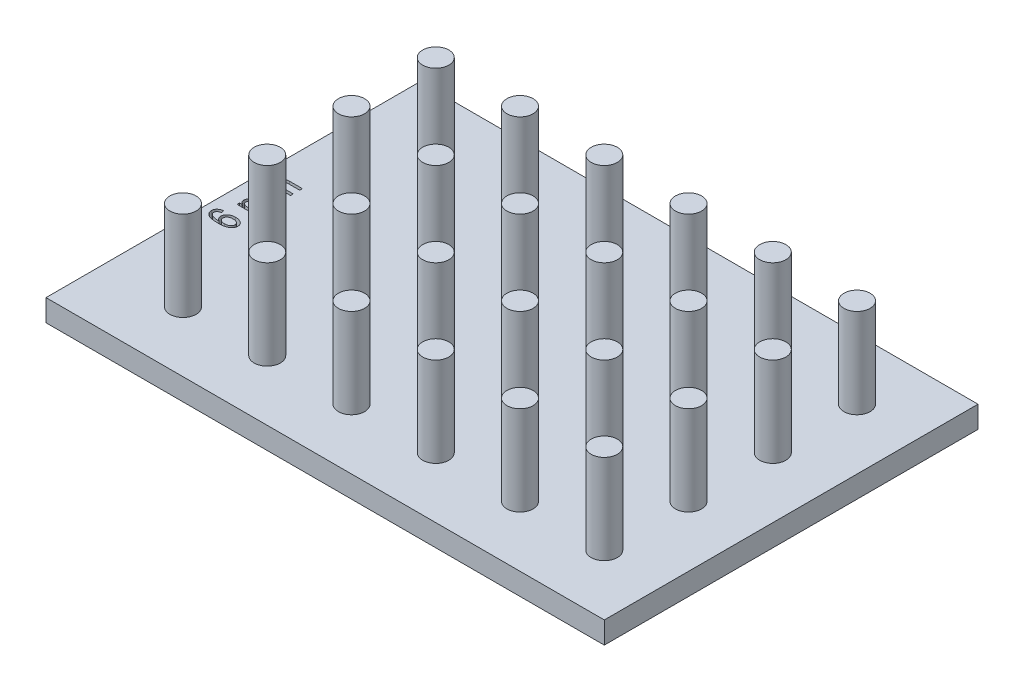
from build123d import *

# Parameters (mm, degrees)
SKETCH2_W            = 3
SKETCH2_H            = 20.5
SKETCH1_W            = 127.89
SKETCH1_H            = 85.6
BOSS_EXTRUDE2_DEPTH  = 5
LPATTERN2_COUNT      = 4
LPATTERN2_PITCH      = 19.3
LPATTERN2_COUNT_DIR2 = 6
LPATTERN2_PITCH_DIR2 = 19.3
CUT_EXTRUDE1_DEPTH   = 2


with BuildPart() as part:
    # Sketch2 → Revolve1 (revolve)
    with BuildSketch(Plane.XY.offset(-28.96), mode=Mode.PRIVATE) as revolve1_sk:
        with Locations((51.575, 10.25)):
            Rectangle(SKETCH2_W, SKETCH2_H)
    revolve1 = revolve(revolve1_sk.sketch.rotate(Axis((50.075, 20.5, -28.96), (0, -1, 0)), 90), axis=Axis((50.075, 20.5, -28.96), (0, -1, 0)))

    # Sketch1 → Boss-Extrude2 (add)
    with BuildSketch(Plane(origin=(0, 0, 0), x_dir=(1, 0, 0), z_dir=(0, 1, 0))):
        Rectangle(SKETCH1_W, SKETCH1_H)
    extrude(amount=-BOSS_EXTRUDE2_DEPTH)

    # LPattern2: Revolve1 4 × 6
    with Locations(*[(-j * LPATTERN2_PITCH_DIR2, 0, i * LPATTERN2_PITCH) for i in range(LPATTERN2_COUNT) for j in range(LPATTERN2_COUNT_DIR2) if (i, j) != (0, 0)]):
        add(revolve1)

    # Sketch5 → Cut-Extrude1 (cut)
    # profile 1 of 3: a face of its own
    with BuildSketch(Plane(origin=(0, 0, 0), x_dir=(1, 0, 0), z_dir=(0, 1, 0))):
        with BuildLine():
            Line((-56.194773063, 3.350649351), (-60.558409427, 3.350649351))
            Line((-60.558409427, 3.350649351), (-60.558409427, 3.896103896))
            Line((-60.558409427, 3.896103896), (-59.943555531, 3.896103896))
            add(Edge.make_bspline(
                [(-59.943555531, 3.896103896), (-59.996794447, 3.926822249), (-60.100876583, 3.98687666), (-60.239062939, 4.097881311), (-60.358476936, 4.22059706), (-60.45906551, 4.354856807), (-60.53843865, 4.499547799), (-60.594562214, 4.652256173), (-60.630633743, 4.811226722), (-60.634416703, 4.91985422), (-60.636331505, 4.974837662)],
                knots=[0, 0, 0, 0, 1.09277774, 2.136381581, 3.142818198, 4.133971442, 5.113525656, 6.068968217, 7.022579197, 8, 8, 8, 8], degree=3))
            add(Edge.make_bspline(
                [(-60.636331505, 4.974837662), (-60.634088382, 5.035494154), (-60.629756514, 5.152632593), (-60.593642069, 5.321259578), (-60.534033829, 5.474930057), (-60.449967949, 5.61337419), (-60.342936808, 5.735607446), (-60.212078766, 5.83806776), (-60.059955808, 5.922516148), (-59.947934839, 5.960743625), (-59.889984102, 5.980519481)],
                knots=[0, 0, 0, 0, 1.074449591, 2.074952659, 3.040944724, 3.983666911, 4.93191895, 5.905012228, 6.916220021, 8, 8, 8, 8], degree=3))
            add(Edge.make_bspline(
                [(-59.889984102, 5.980519481), (-59.949272949, 6.016197543), (-60.06335683, 6.084849441), (-60.215228096, 6.204663761), (-60.346217396, 6.329478457), (-60.452312831, 6.464895925), (-60.534399583, 6.608169484), (-60.59439712, 6.758742834), (-60.628882056, 6.917685108), (-60.633827602, 7.026218799), (-60.636331505, 7.081168831)],
                knots=[0, 0, 0, 0, 1.186540174, 2.283146265, 3.31266017, 4.285248268, 5.224385896, 6.137592124, 7.057072756, 8, 8, 8, 8], degree=3))
            add(Edge.make_bspline(
                [(-60.636331505, 7.081168831), (-60.635662931, 7.122634986), (-60.634352463, 7.203912646), (-60.616274438, 7.32203594), (-60.589881379, 7.433944926), (-60.55255542, 7.53886092), (-60.502559134, 7.636428764), (-60.443253099, 7.728007508), (-60.371944731, 7.8124882), (-60.289567405, 7.8898766), (-60.195568446, 7.959539048), (-60.088171681, 8.0200734), (-59.966788373, 8.068459489), (-59.834255708, 8.112168042), (-59.687932617, 8.142590305), (-59.529427595, 8.165975935), (-59.357322273, 8.17889705), (-59.238218024, 8.180821252), (-59.176510076, 8.181818182)],
                knots=[0, 0, 0, 0, 0.955498422, 1.872868982, 2.749207851, 3.604907424, 4.433768684, 5.272350985, 6.116089355, 6.976944253, 7.873691683, 8.808330241, 9.81133937, 10.882935648, 12.023104474, 13.252889189, 14.57672104, 16, 16, 16, 16], degree=3))
            Line((-59.176510076, 8.181818182), (-56.194773063, 8.181818182))
            Line((-56.194773063, 8.181818182), (-56.194773063, 7.558441558))
            Line((-56.194773063, 7.558441558), (-58.94152631, 7.558441558))
            add(Edge.make_bspline(
                [(-58.94152631, 7.558441558), (-59.013800725, 7.558158833), (-59.147135421, 7.55763725), (-59.33039957, 7.543765251), (-59.48020746, 7.525317134), (-59.599836599, 7.496119694), (-59.696209611, 7.456291357), (-59.778769772, 7.408121641), (-59.84883146, 7.346817558), (-59.908821132, 7.278106609), (-59.954925876, 7.201058055), (-59.988305286, 7.118957756), (-60.010143037, 7.032384914), (-60.01201268, 6.972532559), (-60.012954882, 6.94237013)],
                knots=[0, 0, 0, 0, 1.855735109, 3.42353348, 4.717873352, 5.729162317, 6.575113247, 7.388519106, 8.172054344, 8.955589582, 9.722515337, 10.465842131, 11.226865361, 12, 12, 12, 12], degree=3))
            add(Edge.make_bspline(
                [(-60.012954882, 6.94237013), (-60.0120605, 6.911461559), (-60.010296716, 6.850507632), (-59.995046391, 6.761103107), (-59.971459142, 6.675747526), (-59.935719712, 6.595687443), (-59.894436067, 6.518226441), (-59.83911388, 6.447813239), (-59.776745232, 6.379805077), (-59.704055196, 6.316710767), (-59.619767904, 6.26010977), (-59.525147467, 6.210572613), (-59.419123746, 6.168624023), (-59.30199092, 6.137127013), (-59.174505776, 6.109745853), (-59.035773633, 6.090589511), (-58.885691884, 6.07991367), (-58.782047121, 6.07860086), (-58.728458128, 6.077922078)],
                knots=[0, 0, 0, 0, 0.850256985, 1.676768018, 2.490111268, 3.280810737, 4.085979475, 4.899322724, 5.737306858, 6.624348552, 7.541552425, 8.52603189, 9.55919711, 10.673333412, 11.860946988, 13.147052635, 14.524898187, 16, 16, 16, 16], degree=3))
            Line((-58.728458128, 6.077922078), (-56.194773063, 6.077922078))
            Line((-56.194773063, 6.077922078), (-56.194773063, 5.454545455))
            Line((-56.194773063, 5.454545455), (-59.027971115, 5.454545455))
            add(Edge.make_bspline(
                [(-59.027971115, 5.454545455), (-59.071401885, 5.454068384), (-59.155082966, 5.453149179), (-59.275875268, 5.44643796), (-59.386249391, 5.432484013), (-59.487391484, 5.416281185), (-59.578154996, 5.393239636), (-59.659087752, 5.365698177), (-59.729626819, 5.332364937), (-59.809358656, 5.283392648), (-59.89132759, 5.209261406), (-59.961504189, 5.10165735), (-60.006879034, 4.979116167), (-60.010883285, 4.891241248), (-60.012954882, 4.845779221)],
                knots=[0, 0, 0, 0, 1.193618296, 2.299827258, 3.322171548, 4.249981195, 5.112908464, 5.892447954, 6.595906041, 7.252061334, 8.45997621, 9.595265847, 10.755912475, 12, 12, 12, 12], degree=3))
            add(Edge.make_bspline(
                [(-60.012954882, 4.845779221), (-60.012170325, 4.812836491), (-60.010639858, 4.748573773), (-59.994247841, 4.654897954), (-59.967610277, 4.566957444), (-59.930061932, 4.484375402), (-59.884467922, 4.405414987), (-59.824648938, 4.333858231), (-59.756461905, 4.266572122), (-59.677050321, 4.20426896), (-59.583162357, 4.148998621), (-59.47252185, 4.102007999), (-59.34520472, 4.062245673), (-59.200631396, 4.029684144), (-59.03910095, 4.004785241), (-58.860290467, 3.986773132), (-58.664469746, 3.975917289), (-58.527985697, 3.974673396), (-58.456948388, 3.974025974)],
                knots=[0, 0, 0, 0, 0.785764272, 1.532822213, 2.262268433, 2.973535088, 3.69469776, 4.431634212, 5.192142517, 5.97904095, 6.834803932, 7.785164623, 8.842330306, 10.015178037, 11.319777691, 12.741815971, 14.304178211, 16, 16, 16, 16], degree=3))
            Line((-58.456948388, 3.974025974), (-56.194773063, 3.974025974))
            Line((-56.194773063, 3.974025974), (-56.194773063, 3.350649351))
        make_face()
    # profile 2 of 3: a face of its own
    with BuildSketch(Plane(origin=(0, 0, 0), x_dir=(1, 0, 0), z_dir=(0, 1, 0))):
        with BuildLine():
            Line((-56.194773063, -2.415584416), (-60.558409427, -2.415584416))
            Line((-60.558409427, -2.415584416), (-60.558409427, -1.87012987))
            Line((-60.558409427, -1.87012987), (-59.943555531, -1.87012987))
            add(Edge.make_bspline(
                [(-59.943555531, -1.87012987), (-59.996794447, -1.839411517), (-60.100876583, -1.779357106), (-60.239062939, -1.668352455), (-60.358476936, -1.545636706), (-60.45906551, -1.411376959), (-60.53843865, -1.266685967), (-60.594562214, -1.113977593), (-60.630633743, -0.955007044), (-60.634416703, -0.846379547), (-60.636331505, -0.791396104)],
                knots=[0, 0, 0, 0, 1.09277774, 2.136381581, 3.142818198, 4.133971442, 5.113525656, 6.068968217, 7.022579197, 8, 8, 8, 8], degree=3))
            add(Edge.make_bspline(
                [(-60.636331505, -0.791396104), (-60.634088382, -0.730739612), (-60.629756514, -0.613601173), (-60.593642069, -0.444974188), (-60.534033829, -0.29130371), (-60.449967949, -0.152859576), (-60.342936808, -0.03062632), (-60.212078766, 0.071833994), (-60.059955808, 0.156282382), (-59.947934839, 0.194509859), (-59.889984102, 0.214285714)],
                knots=[0, 0, 0, 0, 1.074449591, 2.074952659, 3.040944724, 3.983666911, 4.93191895, 5.905012228, 6.916220021, 8, 8, 8, 8], degree=3))
            add(Edge.make_bspline(
                [(-59.889984102, 0.214285714), (-59.949272949, 0.249963777), (-60.06335683, 0.318615674), (-60.215228096, 0.438429995), (-60.346217396, 0.563244691), (-60.452312831, 0.698662159), (-60.534399583, 0.841935718), (-60.59439712, 0.992509068), (-60.628882056, 1.151451342), (-60.633827602, 1.259985032), (-60.636331505, 1.314935065)],
                knots=[0, 0, 0, 0, 1.186540174, 2.283146265, 3.31266017, 4.285248268, 5.224385896, 6.137592124, 7.057072756, 8, 8, 8, 8], degree=3))
            add(Edge.make_bspline(
                [(-60.636331505, 1.314935065), (-60.635662931, 1.35640122), (-60.634352463, 1.43767888), (-60.616274438, 1.555802173), (-60.589881379, 1.66771116), (-60.55255542, 1.772627154), (-60.502559134, 1.870194997), (-60.443253099, 1.961773742), (-60.371944731, 2.046254434), (-60.289567405, 2.123642834), (-60.195568446, 2.193305281), (-60.088171681, 2.253839634), (-59.966788373, 2.302225723), (-59.834255708, 2.345934275), (-59.687932617, 2.376356539), (-59.529427595, 2.399742169), (-59.357322273, 2.412663284), (-59.238218024, 2.414587486), (-59.176510076, 2.415584416)],
                knots=[0, 0, 0, 0, 0.955498422, 1.872868982, 2.749207851, 3.604907424, 4.433768684, 5.272350985, 6.116089355, 6.976944253, 7.873691683, 8.808330241, 9.81133937, 10.882935648, 12.023104474, 13.252889189, 14.57672104, 16, 16, 16, 16], degree=3))
            Line((-59.176510076, 2.415584416), (-56.194773063, 2.415584416))
            Line((-56.194773063, 2.415584416), (-56.194773063, 1.792207792))
            Line((-56.194773063, 1.792207792), (-58.94152631, 1.792207792))
            add(Edge.make_bspline(
                [(-58.94152631, 1.792207792), (-59.013800725, 1.791925067), (-59.147135421, 1.791403484), (-59.33039957, 1.777531485), (-59.48020746, 1.759083367), (-59.599836599, 1.729885927), (-59.696209611, 1.690057591), (-59.778769772, 1.641887875), (-59.84883146, 1.580583792), (-59.908821132, 1.511872843), (-59.954925876, 1.434824288), (-59.988305286, 1.35272399), (-60.010143037, 1.266151148), (-60.01201268, 1.206298793), (-60.012954882, 1.176136364)],
                knots=[0, 0, 0, 0, 1.855735109, 3.42353348, 4.717873352, 5.729162317, 6.575113247, 7.388519106, 8.172054344, 8.955589582, 9.722515337, 10.465842131, 11.226865361, 12, 12, 12, 12], degree=3))
            add(Edge.make_bspline(
                [(-60.012954882, 1.176136364), (-60.0120605, 1.145227793), (-60.010296716, 1.084273866), (-59.995046391, 0.994869341), (-59.971459142, 0.90951376), (-59.935719712, 0.829453677), (-59.894436067, 0.751992675), (-59.83911388, 0.681579472), (-59.776745232, 0.613571311), (-59.704055196, 0.550477001), (-59.619767904, 0.493876004), (-59.525147467, 0.444338847), (-59.419123746, 0.402390256), (-59.30199092, 0.370893247), (-59.174505776, 0.343512087), (-59.035773633, 0.324355745), (-58.885691884, 0.313679903), (-58.782047121, 0.312367093), (-58.728458128, 0.311688312)],
                knots=[0, 0, 0, 0, 0.850256985, 1.676768018, 2.490111268, 3.280810737, 4.085979475, 4.899322724, 5.737306858, 6.624348552, 7.541552425, 8.52603189, 9.55919711, 10.673333412, 11.860946988, 13.147052635, 14.524898187, 16, 16, 16, 16], degree=3))
            Line((-58.728458128, 0.311688312), (-56.194773063, 0.311688312))
            Line((-56.194773063, 0.311688312), (-56.194773063, -0.311688312))
            Line((-56.194773063, -0.311688312), (-59.027971115, -0.311688312))
            add(Edge.make_bspline(
                [(-59.027971115, -0.311688312), (-59.071401885, -0.312165382), (-59.155082966, -0.313084587), (-59.275875268, -0.319795806), (-59.386249391, -0.333749753), (-59.487391484, -0.349952581), (-59.578154996, -0.372994131), (-59.659087752, -0.40053559), (-59.729626819, -0.433868829), (-59.809358656, -0.482841118), (-59.89132759, -0.55697236), (-59.961504189, -0.664576416), (-60.006879034, -0.787117599), (-60.010883285, -0.874992518), (-60.012954882, -0.920454545)],
                knots=[0, 0, 0, 0, 1.193618296, 2.299827258, 3.322171548, 4.249981195, 5.112908464, 5.892447954, 6.595906041, 7.252061334, 8.45997621, 9.595265847, 10.755912475, 12, 12, 12, 12], degree=3))
            add(Edge.make_bspline(
                [(-60.012954882, -0.920454545), (-60.012170325, -0.953397275), (-60.010639858, -1.017659993), (-59.994247841, -1.111335812), (-59.967610277, -1.199276323), (-59.930061932, -1.281858364), (-59.884467922, -1.360818779), (-59.824648938, -1.432375535), (-59.756461905, -1.499661645), (-59.677050321, -1.561964806), (-59.583162357, -1.617235145), (-59.47252185, -1.664225768), (-59.34520472, -1.703988094), (-59.200631396, -1.736549622), (-59.03910095, -1.761448526), (-58.860290467, -1.779460634), (-58.664469746, -1.790316478), (-58.527985697, -1.79156037), (-58.456948388, -1.792207792)],
                knots=[0, 0, 0, 0, 0.785764272, 1.532822213, 2.262268433, 2.973535088, 3.69469776, 4.431634212, 5.192142517, 5.97904095, 6.834803932, 7.785164623, 8.842330306, 10.015178037, 11.319777691, 12.741815971, 14.304178211, 16, 16, 16, 16], degree=3))
            Line((-58.456948388, -1.792207792), (-56.194773063, -1.792207792))
            Line((-56.194773063, -1.792207792), (-56.194773063, -2.415584416))
        make_face()
    # profile 3 of 3: a face of its own
    with BuildSketch(Plane(origin=(0, 0, 0), x_dir=(1, 0, 0), z_dir=(0, 1, 0))):
        with BuildLine():
            Line((-60.792175661, -5.220779221), (-60.714253583, -5.844155844))
            add(Edge.make_bspline(
                [(-60.714253583, -5.844155844), (-60.785249682, -5.858565154), (-60.918192866, -5.885547193), (-61.098288758, -5.944070924), (-61.248866279, -6.009277176), (-61.328764668, -6.069577335), (-61.365633453, -6.097402597)],
                knots=[0, 0, 0, 0, 1.230211225, 2.30362229, 3.217213433, 4, 4, 4, 4], degree=3))
            add(Edge.make_bspline(
                [(-61.365633453, -6.097402597), (-61.388410066, -6.117637662), (-61.432697383, -6.156983138), (-61.490065605, -6.222375486), (-61.539507632, -6.289702263), (-61.58021754, -6.360505212), (-61.61065458, -6.435618964), (-61.632440171, -6.51364522), (-61.646328837, -6.594480791), (-61.648316036, -6.649295616), (-61.649318518, -6.676948052)],
                knots=[0, 0, 0, 0, 1.09495211, 2.12904747, 3.12182315, 4.09596367, 5.058329339, 6.028853599, 7.005615717, 8, 8, 8, 8], degree=3))
            add(Edge.make_bspline(
                [(-61.649318518, -6.676948052), (-61.647729096, -6.719786206), (-61.644580132, -6.804657211), (-61.610631166, -6.927822853), (-61.559655114, -7.045076379), (-61.48592932, -7.15477776), (-61.392061183, -7.257136243), (-61.278936122, -7.354330168), (-61.143957369, -7.442704055), (-61.044706348, -7.494006612), (-60.993068518, -7.520698052)],
                knots=[0, 0, 0, 0, 0.906800098, 1.796553483, 2.691003266, 3.610512055, 4.585978966, 5.630213089, 6.767058994, 8, 8, 8, 8], degree=3))
            add(Edge.make_bspline(
                [(-60.993068518, -7.520698052), (-60.943503823, -7.543099762), (-60.840457741, -7.589673405), (-60.6725331, -7.644288034), (-60.488485934, -7.692281364), (-60.28670922, -7.728267537), (-60.069293587, -7.760984812), (-59.8343039, -7.781844935), (-59.582923136, -7.795478488), (-59.409484482, -7.79733798), (-59.320178908, -7.798295455)],
                knots=[0, 0, 0, 0, 0.763508889, 1.587351645, 2.476402758, 3.433472996, 4.464603951, 5.563935012, 6.745641893, 8, 8, 8, 8], degree=3))
            add(Edge.make_bspline(
                [(-59.320178908, -7.798295455), (-59.380941264, -7.762993612), (-59.499172948, -7.694303119), (-59.654204497, -7.566399453), (-59.789037353, -7.428734824), (-59.898912156, -7.277109074), (-59.984257306, -7.116123998), (-60.04552492, -6.949456148), (-60.083997745, -6.778127091), (-60.088577747, -6.662128639), (-60.090876959, -6.603896104)],
                knots=[0, 0, 0, 0, 1.127689085, 2.194262806, 3.218345157, 4.217743143, 5.19231177, 6.137448631, 7.064978137, 8, 8, 8, 8], degree=3))
            add(Edge.make_bspline(
                [(-60.090876959, -6.603896104), (-60.089193459, -6.55549954), (-60.085875387, -6.460113018), (-60.060764956, -6.31935521), (-60.019007195, -6.183854138), (-59.961578425, -6.052352116), (-59.886054743, -5.926156229), (-59.794818391, -5.80437068), (-59.685983146, -5.688523675), (-59.564294352, -5.576586772), (-59.427218313, -5.474971955), (-59.277886745, -5.385847569), (-59.117863913, -5.309796126), (-58.945733044, -5.249434966), (-58.763540348, -5.200490972), (-58.569626292, -5.166516645), (-58.364801039, -5.147480957), (-58.224438943, -5.144422998), (-58.152565271, -5.142857143)],
                knots=[0, 0, 0, 0, 0.860357646, 1.695709716, 2.533583491, 3.377064945, 4.241047709, 5.143225219, 6.077846286, 7.063889573, 8.080111547, 9.106229702, 10.152257742, 11.225204373, 12.345649275, 13.503769734, 14.721782881, 16, 16, 16, 16], degree=3))
            add(Edge.make_bspline(
                [(-58.152565271, -5.142857143), (-58.055027509, -5.145343268), (-57.863961523, -5.150213321), (-57.58420831, -5.191018518), (-57.318851015, -5.259748096), (-57.108492769, -5.337561578), (-56.950925409, -5.412496784), (-56.840922163, -5.471873715), (-56.739481985, -5.536169862), (-56.644006535, -5.601675071), (-56.559303272, -5.674780117), (-56.480087028, -5.748498603), (-56.410894601, -5.828337267), (-56.328923472, -5.937581807), (-56.242999134, -6.081120993), (-56.170882265, -6.265524313), (-56.125008307, -6.457989429), (-56.11958328, -6.58984262), (-56.116850985, -6.65625)],
                knots=[0, 0, 0, 0, 1.657594599, 3.247049531, 4.793269837, 6.310589185, 7.051271314, 7.758283223, 8.434037218, 9.092523529, 9.724148541, 10.334150818, 10.930619913, 11.517069014, 12.655365671, 13.76103642, 14.872354135, 16, 16, 16, 16], degree=3))
            add(Edge.make_bspline(
                [(-56.116850985, -6.65625), (-56.118951647, -6.716057794), (-56.123083345, -6.833691056), (-56.155983765, -7.005909985), (-56.208199344, -7.170115115), (-56.282253451, -7.326545366), (-56.377919567, -7.47478948), (-56.49601221, -7.613568288), (-56.634003416, -7.744806126), (-56.792598989, -7.868756024), (-56.977500024, -7.980195624), (-57.189310729, -8.077437263), (-57.429744989, -8.158675574), (-57.698222336, -8.222686752), (-57.994134795, -8.275191219), (-58.317769759, -8.312103292), (-58.669714855, -8.333832036), (-58.913490479, -8.336352702), (-59.04014644, -8.337662338)],
                knots=[0, 0, 0, 0, 0.76079261, 1.49636878, 2.22335124, 2.948937493, 3.692613516, 4.462506464, 5.262670056, 6.113081641, 7.019393936, 8.004001644, 9.074018115, 10.244225697, 11.513927426, 12.897326774, 14.387976403, 16, 16, 16, 16], degree=3))
            add(Edge.make_bspline(
                [(-59.04014644, -8.337662338), (-59.180607686, -8.336509764), (-59.451184509, -8.334289508), (-59.841530004, -8.31045114), (-60.200588522, -8.274391695), (-60.5282034, -8.220653331), (-60.824961161, -8.154080888), (-61.090388597, -8.06984635), (-61.325886175, -7.973151581), (-61.528964453, -7.856898193), (-61.704159582, -7.729758795), (-61.854912106, -7.593604911), (-61.984769101, -7.450798416), (-62.090579145, -7.297910809), (-62.171345219, -7.135161374), (-62.230849201, -6.964853489), (-62.265305613, -6.785062308), (-62.270206724, -6.662481075), (-62.272695141, -6.600243506)],
                knots=[0, 0, 0, 0, 1.648729313, 3.176021509, 4.589257728, 5.883210501, 7.07130447, 8.156186091, 9.149022935, 10.053769316, 10.896205842, 11.685573168, 12.434569159, 13.157455576, 13.86058765, 14.561213295, 15.269491877, 16, 16, 16, 16], degree=3))
            add(Edge.make_bspline(
                [(-62.272695141, -6.600243506), (-62.271411706, -6.55515224), (-62.268881805, -6.466268542), (-62.252276946, -6.335500514), (-62.221281443, -6.210911925), (-62.17948878, -6.091996053), (-62.127643445, -5.977723853), (-62.060973262, -5.870739), (-61.983693036, -5.768677832), (-61.89480313, -5.672881216), (-61.795055792, -5.583096468), (-61.682178801, -5.504627433), (-61.559985363, -5.433833745), (-61.427572343, -5.370984794), (-61.283864892, -5.319247695), (-61.129457798, -5.276977218), (-60.964877576, -5.242223875), (-60.850751464, -5.228052666), (-60.792175661, -5.220779221)],
                knots=[0, 0, 0, 0, 0.965466884, 1.903123866, 2.815643703, 3.708762019, 4.59904389, 5.49616866, 6.401586744, 7.336219343, 8.290161022, 9.268947462, 10.273430203, 11.311221761, 12.402489703, 13.538768752, 14.73676065, 16, 16, 16, 16], degree=3))
        make_face()
        with BuildLine():
            add(Edge.make_bspline(
                [(-58.175698388, -7.714285714), (-58.122906317, -7.713391472), (-58.019951414, -7.711647524), (-57.869358791, -7.696875069), (-57.726752133, -7.67212067), (-57.591311667, -7.640700706), (-57.465276071, -7.595503515), (-57.345933196, -7.543841167), (-57.235509958, -7.480085801), (-57.133121421, -7.408498627), (-57.041665248, -7.330284291), (-56.961610808, -7.247764127), (-56.892892538, -7.163188114), (-56.83774938, -7.074070788), (-56.792801031, -6.982776041), (-56.762869269, -6.887024792), (-56.743647486, -6.788921298), (-56.741371086, -6.722492005), (-56.740227609, -6.689123377)],
                knots=[0, 0, 0, 0, 1.295915113, 2.527288866, 3.709970359, 4.848208075, 5.935365449, 6.992568332, 8.036874269, 9.05966364, 10.056099687, 10.986214356, 11.87941223, 12.725402229, 13.554321318, 14.370446187, 15.18144582, 16, 16, 16, 16], degree=3))
            add(Edge.make_bspline(
                [(-56.740227609, -6.689123377), (-56.741506697, -6.659427454), (-56.744050819, -6.600361872), (-56.761169699, -6.513260556), (-56.791533534, -6.429426407), (-56.831580779, -6.347237642), (-56.884752928, -6.267776988), (-56.949364201, -6.191093288), (-57.026273447, -6.118152947), (-57.111563066, -6.045835461), (-57.209013197, -5.981517199), (-57.313597962, -5.92127333), (-57.429482757, -5.875339565), (-57.552261833, -5.834069514), (-57.685067207, -5.804823281), (-57.825492226, -5.780714103), (-57.975443154, -5.769620555), (-58.077879232, -5.76738528), (-58.130649687, -5.766233766)],
                knots=[0, 0, 0, 0, 0.772713955, 1.536938285, 2.298458163, 3.087170851, 3.910203315, 4.779624773, 5.690759825, 6.665637977, 7.684919877, 8.72499675, 9.799719792, 10.921806825, 12.09248587, 13.333813582, 14.6265008, 16, 16, 16, 16], degree=3))
            add(Edge.make_bspline(
                [(-58.130649687, -5.766233766), (-58.18221084, -5.767338067), (-58.282231456, -5.769480237), (-58.428371525, -5.781197035), (-58.565079542, -5.802991103), (-58.693557904, -5.833243033), (-58.812186429, -5.873650683), (-58.923300943, -5.920731676), (-59.024556717, -5.978508251), (-59.116948412, -6.043596761), (-59.198130396, -6.116201351), (-59.271338001, -6.190896673), (-59.33017239, -6.272391018), (-59.382019469, -6.355138733), (-59.418862859, -6.443974876), (-59.448115541, -6.535755614), (-59.463317857, -6.632214648), (-59.466099897, -6.697603606), (-59.467500336, -6.730519481)],
                knots=[0, 0, 0, 0, 1.34413917, 2.607420863, 3.817865127, 4.949372023, 6.043265408, 7.080878207, 8.089894499, 9.076140083, 10.020536592, 10.925912695, 11.795477937, 12.63545564, 13.464706931, 14.294565263, 15.141508349, 16, 16, 16, 16], degree=3))
            add(Edge.make_bspline(
                [(-59.467500336, -6.730519481), (-59.466825548, -6.763080588), (-59.46549145, -6.827455825), (-59.446960945, -6.921581534), (-59.420847276, -7.01320098), (-59.380688321, -7.100729093), (-59.332315587, -7.186547002), (-59.272017906, -7.268477125), (-59.200485222, -7.346593494), (-59.119580574, -7.42181743), (-59.028957382, -7.49080903), (-58.929539199, -7.551173585), (-58.822052144, -7.600345577), (-58.707776354, -7.642309283), (-58.585621237, -7.675254982), (-58.455619505, -7.697896474), (-58.318028829, -7.711392006), (-58.224025102, -7.713303188), (-58.175698388, -7.714285714)],
                knots=[0, 0, 0, 0, 0.863336265, 1.706866888, 2.538958102, 3.388184842, 4.257154246, 5.151813003, 6.08274342, 7.06663784, 8.081968542, 9.102321145, 10.14869887, 11.215962244, 12.332381785, 13.503694224, 14.716665185, 16, 16, 16, 16], degree=3))
        make_face(mode=Mode.SUBTRACT)
    extrude(amount=-CUT_EXTRUDE1_DEPTH, mode=Mode.SUBTRACT)


solid = part.part
